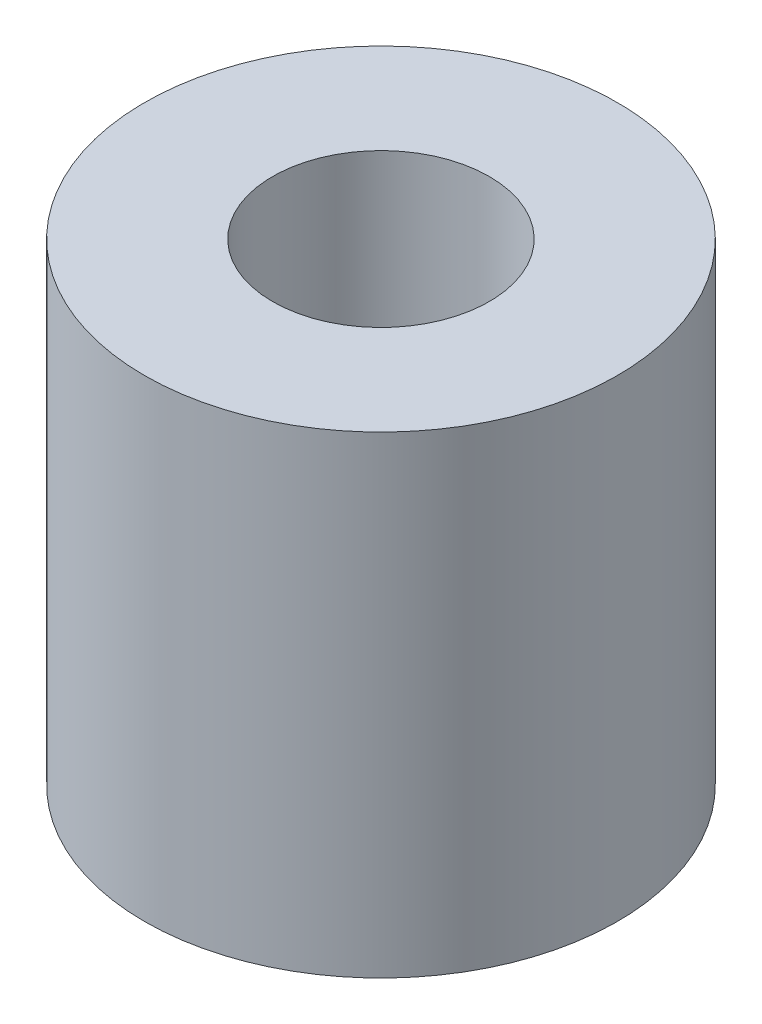
from build123d import *

# Parameters (mm, degrees)
SKETCH1_R           = 3
SKETCH1_R_2         = 1.375
BOSS_EXTRUDE1_DEPTH = 6


with BuildPart() as part:
    # Sketch1 → Boss-Extrude1 (new body)
    with BuildSketch(Plane(origin=(0, 0, 0), x_dir=(1, 0, 0), z_dir=(0, 1, 0))):
        with Locations(Location((0, 0, 0), (0, 0, 270))):
            Circle(SKETCH1_R)
        with Locations(Location((0, 0, 0), (0, 0, 270))):
            Circle(SKETCH1_R_2, mode=Mode.SUBTRACT)
    extrude(amount=BOSS_EXTRUDE1_DEPTH)


solid = part.part
